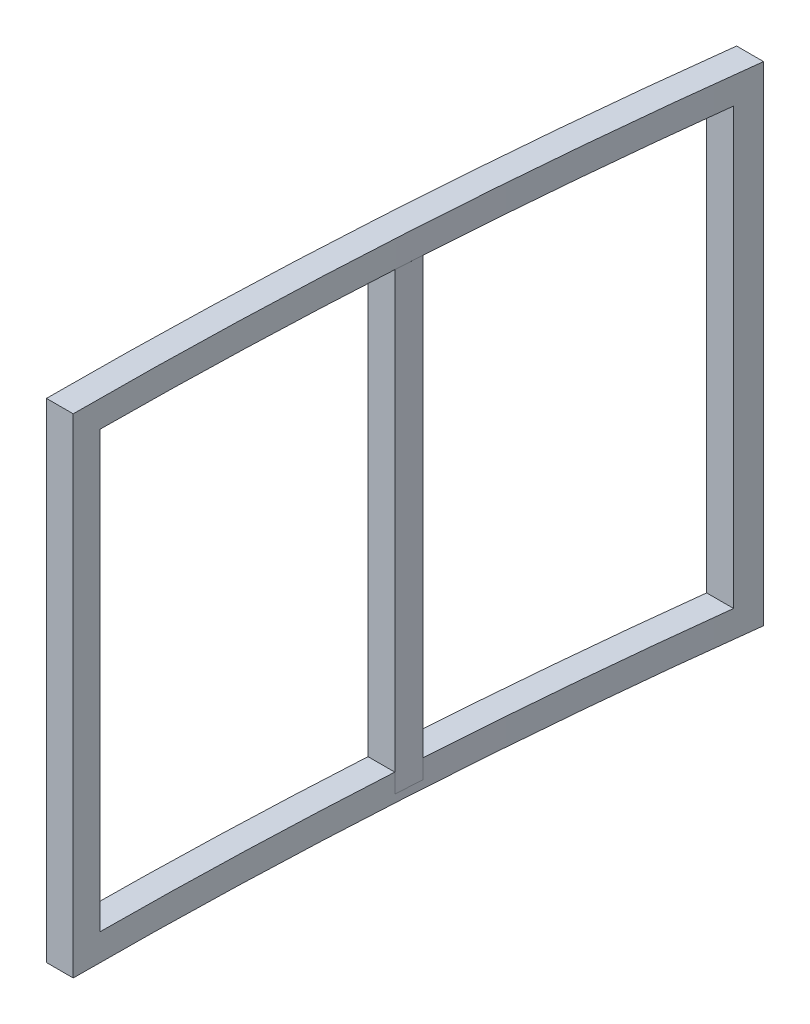
from build123d import *

# Parameters (mm, degrees)
BOSS_EXTRUDE1_DEPTH = 914.4
SKETCH2_W           = 1116.884471925
SKETCH2_H           = 814.4
CUT_EXTRUDE1_DEPTH  = 19950.853735504
BOSS_EXTRUDE3_DEPTH = 850


with BuildPart() as part:
    # Sketch1 → Boss-Extrude1 (new body)
    with BuildSketch(Plane(origin=(0, 0, 0), x_dir=(1, 0, 0), z_dir=(0, 1, 0))):
        with BuildLine():
            Line((-9820.644594144, 1216.884471925), (-9871.125792152, 1216.884471925))
            ThreePointArc((-9871.125792152, 1216.884471925), (-9927.151370921, 609.588288366), (-9945.85, 0))
            Line((-9945.85, 0), (-9895.75, 0))
            ThreePointArc((-9895.75, 0), (-9876.955801384, 609.6), (-9820.644594144, 1216.884471925))
        make_face()
    extrude(amount=BOSS_EXTRUDE1_DEPTH)

    # Sketch2 → Cut-Extrude1 (cut, through all)
    with BuildSketch(Plane(origin=(9945.85, 0, 0), x_dir=(0, 0, -1), z_dir=(1, 0, 0))):
        with Locations((608.442235963, 457.2)):
            Rectangle(SKETCH2_W, SKETCH2_H)
    extrude(amount=-CUT_EXTRUDE1_DEPTH, mode=Mode.SUBTRACT)

    # Sketch5 → Boss-Extrude3 (add)
    with BuildSketch(Plane.XZ.offset(-864.4)):
        Polygon((-9925.583865068, -634.6), (-9875.381051003, -634.6), (-9878.46703201, -584.6), (-9928.654242268, -584.6), align=None)
    extrude(amount=BOSS_EXTRUDE3_DEPTH)


solid = part.part
